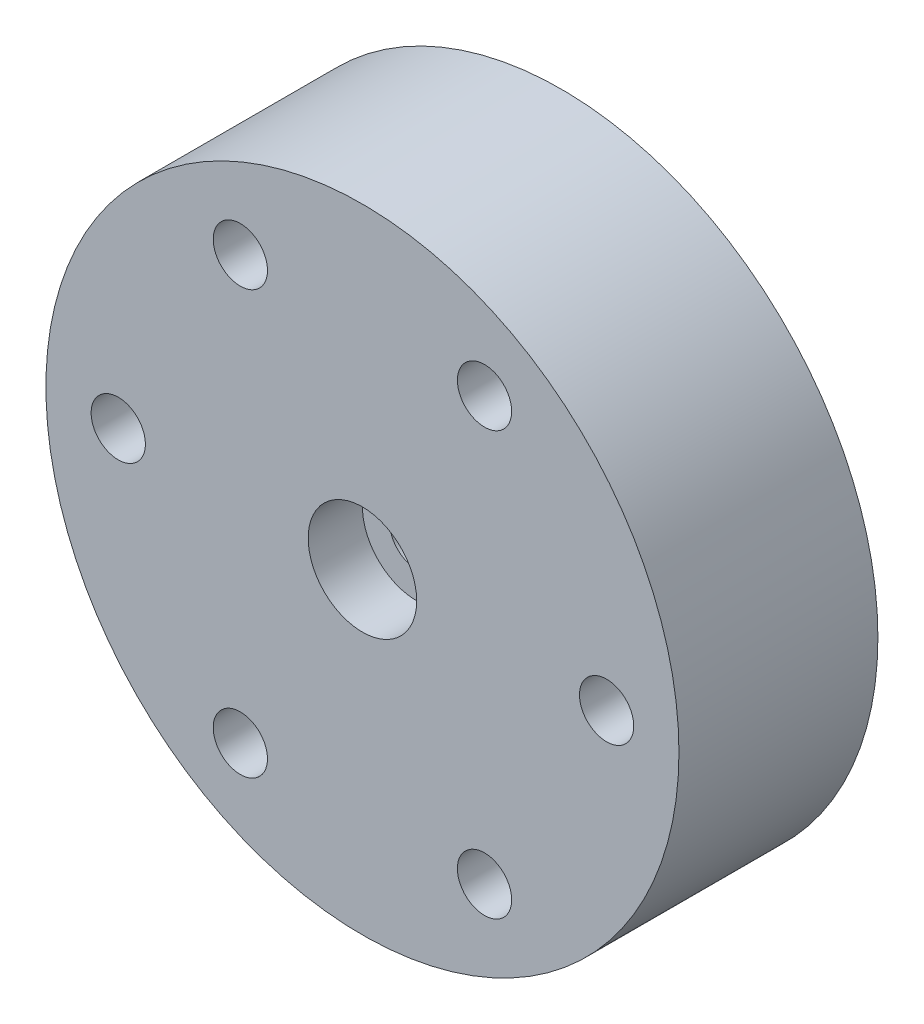
from build123d import *

# Parameters (mm, degrees)
SKETCH_1_R               = 17.5
EXTRUDE_1_DEPTH          = 11
SKETCH_2_R               = 1.5
CUT_EXTRUDE_1_DEPTH      = 6
PATTERN_CIRCULAR_1_COUNT = 6
SKETCH_3_R               = 3
CUT_EXTRUDE_2_DEPTH      = 3
SKETCH_4_R               = 1.5
CUT_EXTRUDE_3_DEPTH      = 6


with BuildPart() as part:
    # 草图1 → 凸台-拉伸1 (new body)
    with BuildSketch(Plane.XY):
        Circle(SKETCH_1_R)
    extrude(amount=EXTRUDE_1_DEPTH)

    # 草图2 → 切除-拉伸1 (cut)
    with BuildSketch(Plane.XY.offset(11)):
        with Locations((13.5, 0)):
            Circle(SKETCH_2_R)
    cut_extrude_1 = extrude(amount=-CUT_EXTRUDE_1_DEPTH, mode=Mode.SUBTRACT)

    # 阵列(圆周)1: 切除-拉伸1 ×6 about axis
    pattern_circular_1_axis = Axis((0, 0, 0), (0, 0, 1))
    for i in range(1, PATTERN_CIRCULAR_1_COUNT):
        add(cut_extrude_1.rotate(pattern_circular_1_axis, i * 360 / PATTERN_CIRCULAR_1_COUNT), mode=Mode.SUBTRACT)

    # 草图3 → 切除-拉伸2 (cut)
    with BuildSketch(Plane.XY.offset(11)):
        Circle(SKETCH_3_R)
    extrude(amount=-CUT_EXTRUDE_2_DEPTH, mode=Mode.SUBTRACT)

    # 草图4 → 切除-拉伸3 (cut)
    with BuildSketch(Plane.XY.offset(8)):
        Circle(SKETCH_4_R)
    extrude(amount=-CUT_EXTRUDE_3_DEPTH, mode=Mode.SUBTRACT)


solid = part.part
